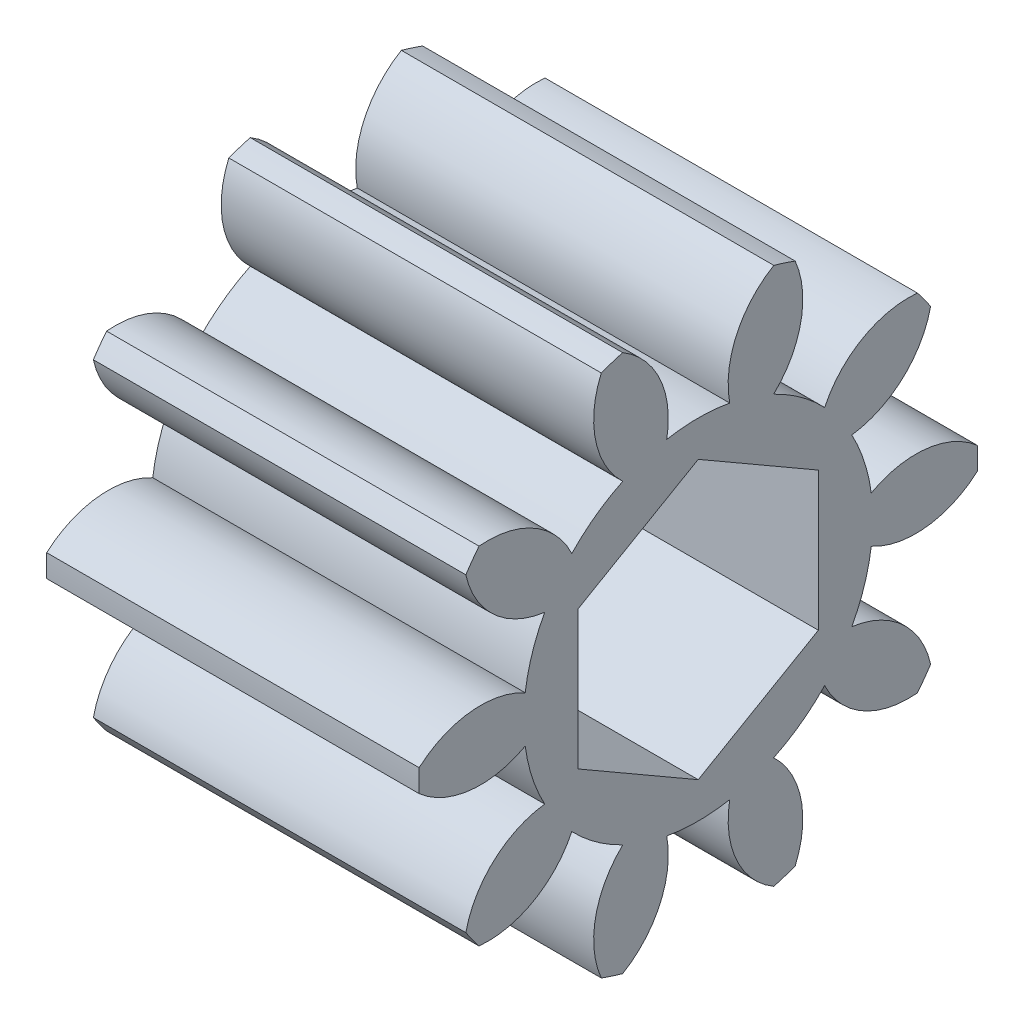
from build123d import *
from build123d.topology import SkipClean

# Parameters (mm, degrees)
BASPROSKE_W         = 14
BASPROSKE_H         = 15
TOOTHCUT_DEPTH      = 26.416530054
TEETHCUTS_COUNT     = 10
TEETHCUTS_ANGLE     = 324
BORSKE_R            = 5
BORE_DEPTH          = 50.0000508
CUT_EXTRUDE1_DEPTH  = 26.09062294
BOSS_EXTRUDE1_DEPTH = 6


with BuildPart() as part:
    # BasProSke → Base-Revolve (revolve)
    with BuildSketch(Plane(origin=(0, 0, 0), x_dir=(1, 0, 0), z_dir=(0, 1, 0)), mode=Mode.PRIVATE) as base_revolve_sk:
        with Locations((7, 7.5)):
            Rectangle(BASPROSKE_W, BASPROSKE_H)
    revolve(base_revolve_sk.sketch.rotate(Axis((-10, 0, 0), (1, 0, 0)), 180), axis=Axis((-10, 0, 0), (1, 0, 0)))

    # TooCutSke → ToothCut (cut, through all)
    with BuildSketch(Plane(origin=(0, 0, 0), x_dir=(0, 0, -1), z_dir=(1, 0, 0))):
        with BuildLine():
            ThreePointArc((1.691642647, 9.220098761), (0, 9.374), (-1.691642647, 9.220098761))
            ThreePointArc((-1.691642647, 9.220098761), (-2.059354944, 12.219114282), (-4.087513468, 14.458730194))
            ThreePointArc((-4.087513468, 14.458730194), (0, 15.0254), (4.087513468, 14.458730194))
            ThreePointArc((4.087513468, 14.458730194), (2.059354944, 12.219114282), (1.691642647, 9.220098761))
        make_face()
    toothcut = extrude(amount=TOOTHCUT_DEPTH, mode=Mode.SUBTRACT)

    # TeethCuts: ToothCut ×10 about axis
    teethcuts_axis = Axis((-10, 0, 0), (1, 0, 0))
    for i in range(1, TEETHCUTS_COUNT):
        add(toothcut.rotate(teethcuts_axis, i * TEETHCUTS_ANGLE / (TEETHCUTS_COUNT - 1)), mode=Mode.SUBTRACT)

    # BorSke → Bore (cut, symmetric)
    with BuildSketch(Plane(origin=(0, 0, 0), x_dir=(0, 0, -1), z_dir=(1, 0, 0))):
        with Locations(Location((0, 0, 0), (0, 0, 180))):
            Circle(BORSKE_R)
    extrude(amount=BORE_DEPTH, both=True, mode=Mode.SUBTRACT)

    # Sketch1 → Cut-Extrude1 (cut, through all)
    with BuildSketch(Plane(origin=(14, 0, 0), x_dir=(0, 0, -1), z_dir=(1, 0, 0))):
        Polygon((0, -7.447818473), (6.45, -3.723909236), (6.45, 3.723909236), (0, 7.447818473), (-6.45, 3.723909236), (-6.45, -3.723909236), align=None)
    extrude(amount=-CUT_EXTRUDE1_DEPTH, mode=Mode.SUBTRACT)

    # Sketch2 → Boss-Extrude1 (add)
    with SkipClean():  # the faces are left unmerged after this step: merging them gives an invalid solid
        with BuildSketch(Plane(origin=(14, 0, 0), x_dir=(0, 0, -1), z_dir=(1, 0, 0))):
            with BuildLine():
                ThreePointArc((14.987839303, -0.603881639), (15, 0), (14.987839303, 0.603881639))
                ThreePointArc((14.987839303, 0.603881639), (12.239957624, 1.819335924), (9.291581333, 1.240319444))
                ThreePointArc((9.291581333, 1.240319444), (8.915203784, 2.896725305), (8.246088681, 4.45801497))
                ThreePointArc((8.246088681, 4.45801497), (10.971712553, 5.7225929), (12.480369426, 8.321080397))
                ThreePointArc((12.480369426, 8.321080397), (12.135254916, 8.816778784), (11.770463983, 9.298181415))
                ThreePointArc((11.770463983, 9.298181415), (8.832954904, 8.666340261), (6.788005726, 6.464893987))
                ThreePointArc((6.788005726, 6.464893987), (5.509898955, 7.583725305), (4.050870426, 8.453539187))
                ThreePointArc((4.050870426, 8.453539187), (5.512646202, 11.078685739), (5.205822621, 14.067672545))
                ThreePointArc((5.205822621, 14.067672545), (4.635254916, 14.265847744), (4.057171486, 14.440891923))
                ThreePointArc((4.057171486, 14.440891923), (2.052063631, 12.203097177), (1.691642647, 9.220098761))
                ThreePointArc((1.691642647, 9.220098761), (0, 9.374), (-1.691642647, 9.220098761))
                ThreePointArc((-1.691642647, 9.220098761), (-2.052063631, 12.203097177), (-4.057171486, 14.440891923))
                ThreePointArc((-4.057171486, 14.440891923), (-4.635254916, 14.265847744), (-5.205822621, 14.067672545))
                ThreePointArc((-5.205822621, 14.067672545), (-5.512646202, 11.078685739), (-4.050870426, 8.453539187))
                ThreePointArc((-4.050870426, 8.453539187), (-5.509898955, 7.583725305), (-6.788005726, 6.464893987))
                ThreePointArc((-6.788005726, 6.464893987), (-8.832954904, 8.666340261), (-11.770463983, 9.298181415))
                ThreePointArc((-11.770463983, 9.298181415), (-12.135254916, 8.816778784), (-12.480369426, 8.321080397))
                ThreePointArc((-12.480369426, 8.321080397), (-10.971712553, 5.7225929), (-8.246088681, 4.45801497))
                ThreePointArc((-8.246088681, 4.45801497), (-8.915203784, 2.896725305), (-9.291581333, 1.240319444))
                ThreePointArc((-9.291581333, 1.240319444), (-12.239957624, 1.819335924), (-14.987839303, 0.603881639))
                ThreePointArc((-14.987839303, 0.603881639), (-15, 0), (-14.987839303, -0.603881639))
                ThreePointArc((-14.987839303, -0.603881639), (-12.239957624, -1.819335924), (-9.291581333, -1.240319444))
                ThreePointArc((-9.291581333, -1.240319444), (-8.915203784, -2.896725305), (-8.246088681, -4.45801497))
                ThreePointArc((-8.246088681, -4.45801497), (-10.971712553, -5.7225929), (-12.480369426, -8.321080397))
                ThreePointArc((-12.480369426, -8.321080397), (-12.135254916, -8.816778784), (-11.770463983, -9.298181415))
                ThreePointArc((-11.770463983, -9.298181415), (-8.832954904, -8.666340261), (-6.788005726, -6.464893987))
                ThreePointArc((-6.788005726, -6.464893987), (-5.509898955, -7.583725305), (-4.050870426, -8.453539187))
                ThreePointArc((-4.050870426, -8.453539187), (-5.512646202, -11.078685739), (-5.205822621, -14.067672545))
                ThreePointArc((-5.205822621, -14.067672545), (-4.635254916, -14.265847744), (-4.057171486, -14.440891923))
                ThreePointArc((-4.057171486, -14.440891923), (-2.052063631, -12.203097177), (-1.691642647, -9.220098761))
                ThreePointArc((-1.691642647, -9.220098761), (0, -9.374), (1.691642647, -9.220098761))
                ThreePointArc((1.691642647, -9.220098761), (2.052063631, -12.203097177), (4.057171486, -14.440891923))
                ThreePointArc((4.057171486, -14.440891923), (4.635254916, -14.265847744), (5.205822621, -14.067672545))
                ThreePointArc((5.205822621, -14.067672545), (5.512646202, -11.078685739), (4.050870426, -8.453539187))
                ThreePointArc((4.050870426, -8.453539187), (5.509898955, -7.583725305), (6.788005726, -6.464893987))
                ThreePointArc((6.788005726, -6.464893987), (8.832954904, -8.666340261), (11.770463983, -9.298181415))
                ThreePointArc((11.770463983, -9.298181415), (12.135254916, -8.816778784), (12.480369426, -8.321080397))
                ThreePointArc((12.480369426, -8.321080397), (10.971712553, -5.7225929), (8.246088681, -4.45801497))
                ThreePointArc((8.246088681, -4.45801497), (8.915203784, -2.896725305), (9.291581333, -1.240319444))
                ThreePointArc((9.291581333, -1.240319444), (12.239957624, -1.819335924), (14.987839303, -0.603881639))
            make_face()
            Polygon((-6.45, -3.723909236), (0, -7.447818473), (6.45, -3.723909236), (6.45, 3.723909236), (0, 7.447818473), (-6.45, 3.723909236), align=None, mode=Mode.SUBTRACT)
        extrude(amount=BOSS_EXTRUDE1_DEPTH)


solid = part.part
